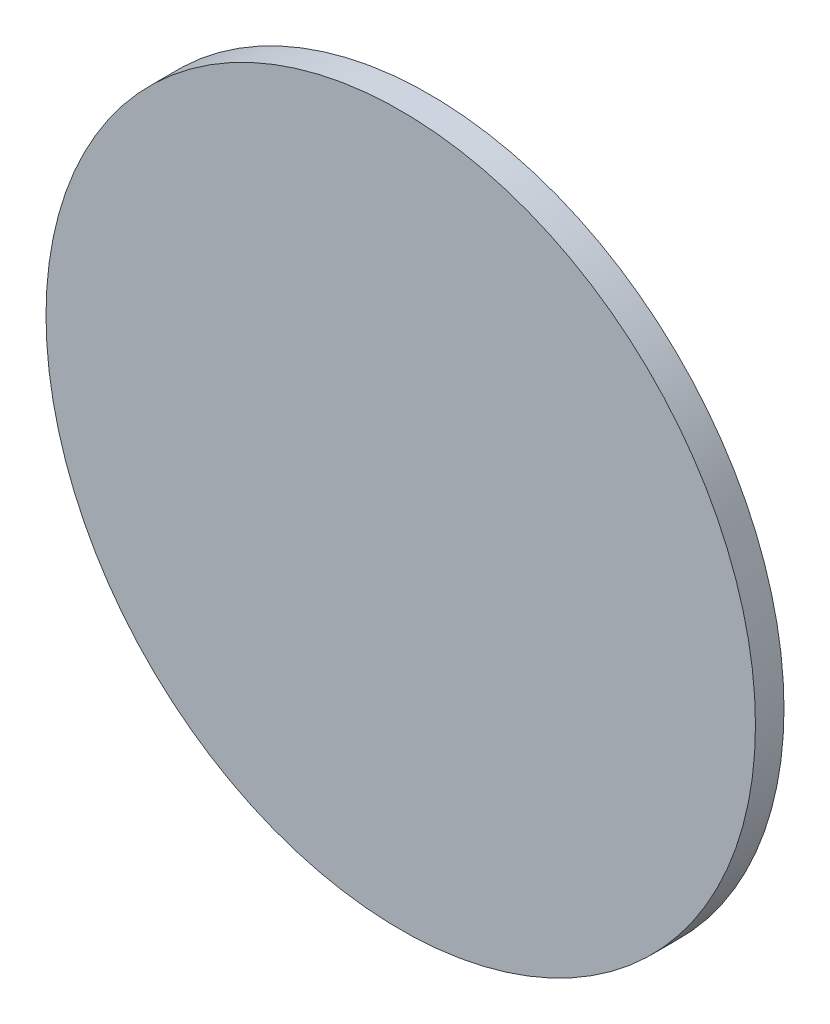
from build123d import *

# Parameters (mm, degrees)
SKETCH2_R           = 24.875
BOSS_EXTRUDE1_DEPTH = 2


with BuildPart() as part:
    # Sketch2 → Boss-Extrude1 (new body)
    with BuildSketch(Plane.XY):
        Circle(SKETCH2_R)
    extrude(amount=BOSS_EXTRUDE1_DEPTH)


solid = part.part
